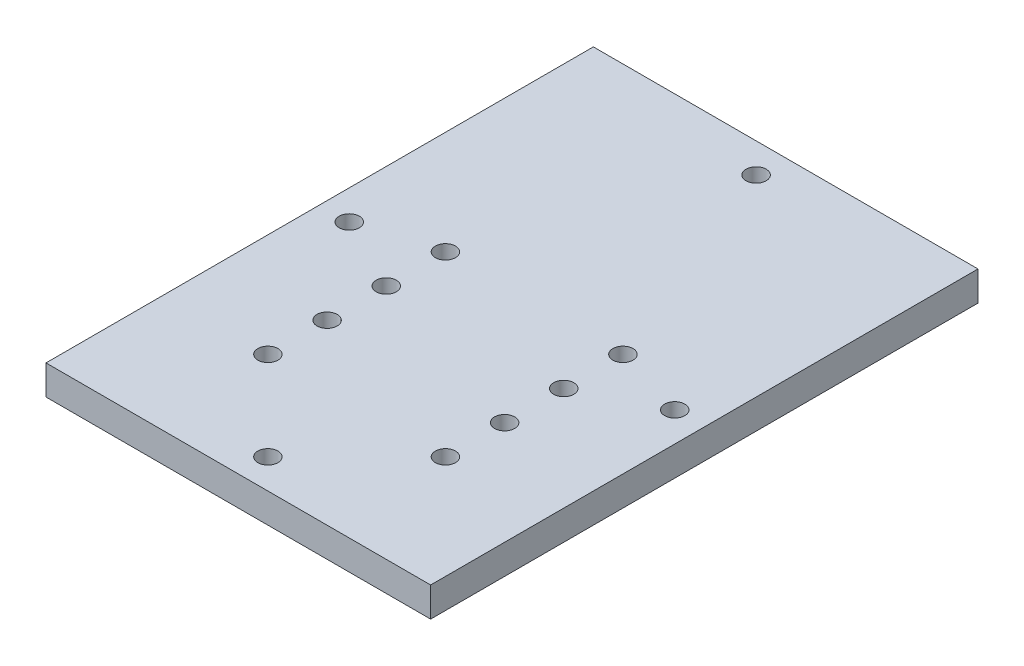
from build123d import *

# Parameters (mm, degrees)
SKETCH1_W           = 330.2
SKETCH1_H           = 469.9
SKETCH1_R           = 8.6487
BOSS_EXTRUDE1_DEPTH = 25.4


with BuildPart() as part:
    # Sketch1 → Boss-Extrude1 (new body)
    with BuildSketch(Plane(origin=(0, 0, 0), x_dir=(1, 0, 0), z_dir=(0, 1, 0))):
        with Locations((-165.1, 234.95)):
            Rectangle(SKETCH1_W, SKETCH1_H)
        with Locations(Location((-165.1, 444.5, 0), (0, 0, 270))):
            Circle(SKETCH1_R, mode=Mode.SUBTRACT)
        with Locations(Location((-25.4, 234.95, 0), (0, 0, 270))):
            Circle(SKETCH1_R, mode=Mode.SUBTRACT)
        with Locations(Location((-165.1, 25.4, 0), (0, 0, 270))):
            Circle(SKETCH1_R, mode=Mode.SUBTRACT)
        with Locations(Location((-304.8, 234.95, 0), (0, 0, 270))):
            Circle(SKETCH1_R, mode=Mode.SUBTRACT)
        with Locations(Location((-88.9, 101.6, 0), (0, 0, 270))):
            Circle(SKETCH1_R, mode=Mode.SUBTRACT)
        with Locations(Location((-88.9, 152.4, 0), (0, 0, 270))):
            Circle(SKETCH1_R, mode=Mode.SUBTRACT)
        with Locations(Location((-88.9, 203.2, 0), (0, 0, 270))):
            Circle(SKETCH1_R, mode=Mode.SUBTRACT)
        with Locations(Location((-88.9, 254, 0), (0, 0, 270))):
            Circle(SKETCH1_R, mode=Mode.SUBTRACT)
        with Locations(Location((-241.3, 101.6, 0), (0, 0, 270))):
            Circle(SKETCH1_R, mode=Mode.SUBTRACT)
        with Locations(Location((-241.3, 152.4, 0), (0, 0, 270))):
            Circle(SKETCH1_R, mode=Mode.SUBTRACT)
        with Locations(Location((-241.3, 203.2, 0), (0, 0, 270))):
            Circle(SKETCH1_R, mode=Mode.SUBTRACT)
        with Locations(Location((-241.3, 254, 0), (0, 0, 270))):
            Circle(SKETCH1_R, mode=Mode.SUBTRACT)
    extrude(amount=BOSS_EXTRUDE1_DEPTH)


solid = part.part
